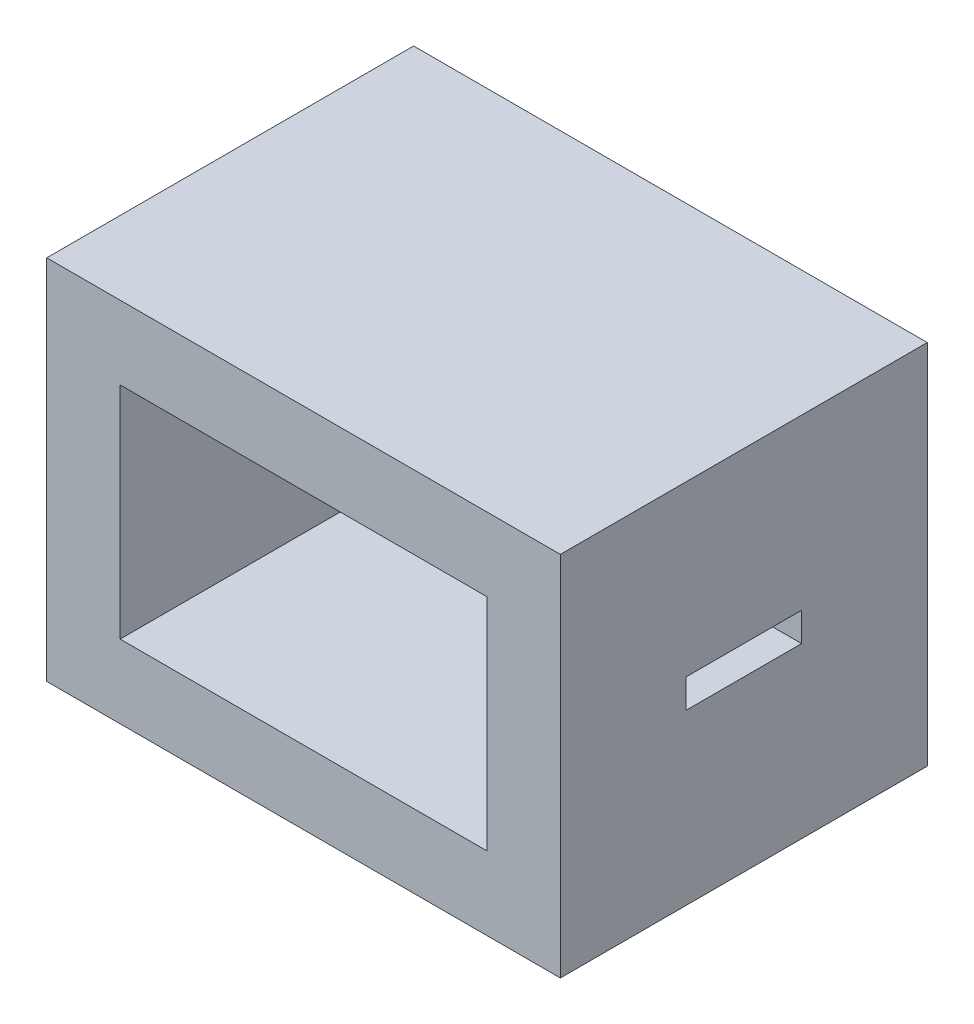
from build123d import *

# Parameters (mm, degrees)
IZIM1_W                     = 12.7
IZIM1_H                     = 12.7
Y_KSEKLIK_EKSTR_ZYON1_DEPTH = 2.54
IZIM2_W                     = 4
IZIM2_H                     = 1
KES_EKSTR_ZYON1_DEPTH       = 2.54
IZIM3_W                     = 12.7
IZIM3_H                     = 12.7
Y_KSEKLIK_EKSTR_ZYON2_DEPTH = 2.54
IZIM4_W                     = 12.7
IZIM4_H                     = 12.7
Y_KSEKLIK_EKSTR_ZYON3_DEPTH = 2.54
IZIM5_W                     = 12.7
IZIM5_H                     = 7.62
Y_KSEKLIK_EKSTR_ZYON4_DEPTH = 2.54
IZIM7_W                     = 12.7
IZIM7_H                     = 12.7
Y_KSEKLIK_EKSTR_ZYON6_DEPTH = 2.54
IZIM8_W                     = 4
IZIM8_H                     = 1
KES_EKSTR_ZYON2_DEPTH       = 2.54


with BuildPart() as part:
    # Çizim1 → Yükseklik-Ekstrüzyon1 (new body)
    with BuildSketch(Plane(origin=(0, 0, 0), x_dir=(0, 0, -1), z_dir=(1, 0, 0))):
        Rectangle(IZIM1_W, IZIM1_H)
    extrude(amount=Y_KSEKLIK_EKSTR_ZYON1_DEPTH)

    # Çizim2 → Kes-Ekstrüzyon1 (cut)
    with BuildSketch(Plane(origin=(2.54, 0, 0), x_dir=(0, 0, -1), z_dir=(1, 0, 0))):
        Rectangle(IZIM2_W, IZIM2_H)
    extrude(amount=-KES_EKSTR_ZYON1_DEPTH, mode=Mode.SUBTRACT)

    # Çizim3 → Yükseklik-Ekstrüzyon2 (add)
    with BuildSketch(Plane(origin=(0, 6.35, 0), x_dir=(1, 0, 0), z_dir=(0, 1, 0))):
        with Locations((8.89, 0)):
            Rectangle(IZIM3_W, IZIM3_H)
    extrude(amount=-Y_KSEKLIK_EKSTR_ZYON2_DEPTH)

    # Çizim4 → Yükseklik-Ekstrüzyon3 (add)
    with BuildSketch(Plane.XZ.offset(6.35)):
        with Locations((8.89, 0)):
            Rectangle(IZIM4_W, IZIM4_H)
    extrude(amount=-Y_KSEKLIK_EKSTR_ZYON3_DEPTH)

    # Çizim5 → Yükseklik-Ekstrüzyon4 (add)
    with BuildSketch(Plane(origin=(0, 0, -6.35), x_dir=(-1, 0, 0), z_dir=(0, 0, -1))):
        with Locations((-8.89, 0)):
            Rectangle(IZIM5_W, IZIM5_H)
    extrude(amount=-Y_KSEKLIK_EKSTR_ZYON4_DEPTH)

    # Çizim7 → Yükseklik-Ekstrüzyon6 (add)
    with BuildSketch(Plane(origin=(15.24, 0, 0), x_dir=(0, 0, -1), z_dir=(1, 0, 0))):
        Rectangle(IZIM7_W, IZIM7_H)
    extrude(amount=Y_KSEKLIK_EKSTR_ZYON6_DEPTH)

    # Çizim8 → Kes-Ekstrüzyon2 (cut)
    with BuildSketch(Plane.ZY.offset(-15.24)):
        Rectangle(IZIM8_W, IZIM8_H)
    extrude(amount=-KES_EKSTR_ZYON2_DEPTH, mode=Mode.SUBTRACT)


solid = part.part
